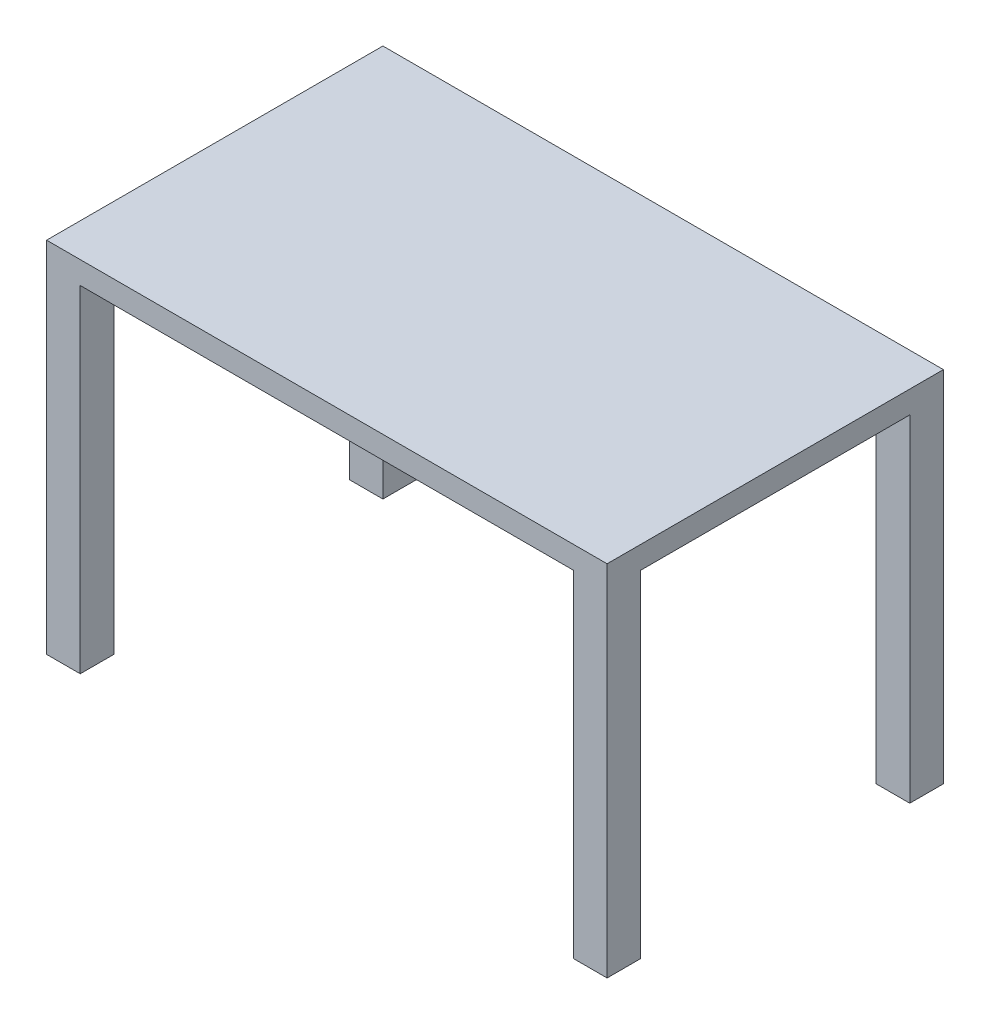
from build123d import *

# Parameters (mm, degrees)
SKETCH1_W           = 250
SKETCH1_H           = 150
BOSS_EXTRUDE1_DEPTH = 10
SKETCH4_W           = 15
SKETCH4_H           = 15
BOSS_EXTRUDE2_DEPTH = 150


with BuildPart() as part:
    # Sketch1 → Boss-Extrude1 (new body)
    with BuildSketch(Plane(origin=(0, 0, 0), x_dir=(1, 0, 0), z_dir=(0, 1, 0))):
        Rectangle(SKETCH1_W, SKETCH1_H)
    extrude(amount=BOSS_EXTRUDE1_DEPTH)

    # Sketch4 → Boss-Extrude2 (add)
    with BuildSketch(Plane.XZ):
        with Locations((117.5, -67.5)):
            Rectangle(SKETCH4_W, SKETCH4_H)
        with Locations((117.5, 67.5)):
            Rectangle(SKETCH4_W, SKETCH4_H)
        with Locations((-117.5, 67.5)):
            Rectangle(SKETCH4_W, SKETCH4_H)
        with Locations((-117.5, -67.5)):
            Rectangle(SKETCH4_W, SKETCH4_H)
    extrude(amount=BOSS_EXTRUDE2_DEPTH)


solid = part.part
